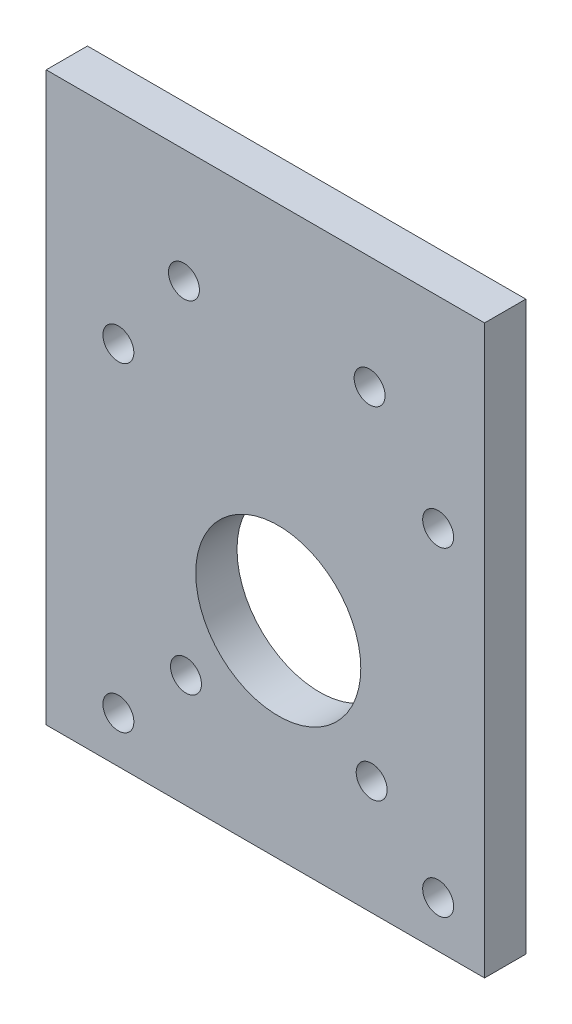
from build123d import *

# Parameters (mm, degrees)
SKETCH1_W           = 42.5
SKETCH1_H           = 40
BOSS_EXTRUDE1_DEPTH = 2
SKETCH2_R           = 1.5
CUT_EXTRUDE1_DEPTH  = 4
SKETCH3_R           = 8
CUT_EXTRUDE2_DEPTH  = 4
SKETCH4_W           = 42.5
SKETCH4_H           = 4
BOSS_EXTRUDE2_DEPTH = 15
SKETCH7_R           = 1.5
CUT_EXTRUDE3_DEPTH  = 10


with BuildPart() as part:
    # Sketch1 → Boss-Extrude1 (new, symmetric)
    with BuildSketch(Plane.XY):
        Rectangle(SKETCH1_W, SKETCH1_H)
    extrude(amount=BOSS_EXTRUDE1_DEPTH, both=True)

    # Sketch2 → Cut-Extrude1 (cut)
    with BuildSketch(Plane(origin=(0, 0, -2), x_dir=(-1, 0, 0), z_dir=(0, 0, -1))):
        with Locations((-16.75, 15.5)):
            Circle(SKETCH2_R)
        with Locations((14.25, 15.5)):
            Circle(SKETCH2_R)
        with Locations((14.25, -15.5)):
            Circle(SKETCH2_R)
        with Locations((-16.75, -15.5)):
            Circle(SKETCH2_R)
    extrude(amount=-CUT_EXTRUDE1_DEPTH, mode=Mode.SUBTRACT)

    # Sketch3 → Cut-Extrude2 (cut)
    with BuildSketch(Plane.XY.offset(2)):
        with Locations((1.25, 0)):
            Circle(SKETCH3_R)
    extrude(amount=-CUT_EXTRUDE2_DEPTH, mode=Mode.SUBTRACT)

    # Sketch4 → Boss-Extrude2 (add)
    with BuildSketch(Plane(origin=(0, 20, 0), x_dir=(1, 0, 0), z_dir=(0, 1, 0))):
        Rectangle(SKETCH4_W, SKETCH4_H)
    extrude(amount=BOSS_EXTRUDE2_DEPTH)

    # Sketch7 → Cut-Extrude3 (cut)
    with BuildSketch(Plane.XY.offset(2)):
        with Locations((-7.894013049, 23.945501151)):
            Circle(SKETCH7_R)
        with Locations((10.105662158, 24.053632735)):
            Circle(SKETCH7_R)
        with Locations((10.303903396, -8.945771811)):
            Circle(SKETCH7_R)
        with Locations((-7.695771811, -9.053903396)):
            Circle(SKETCH7_R)
    extrude(amount=-CUT_EXTRUDE3_DEPTH, mode=Mode.SUBTRACT)


solid = part.part
